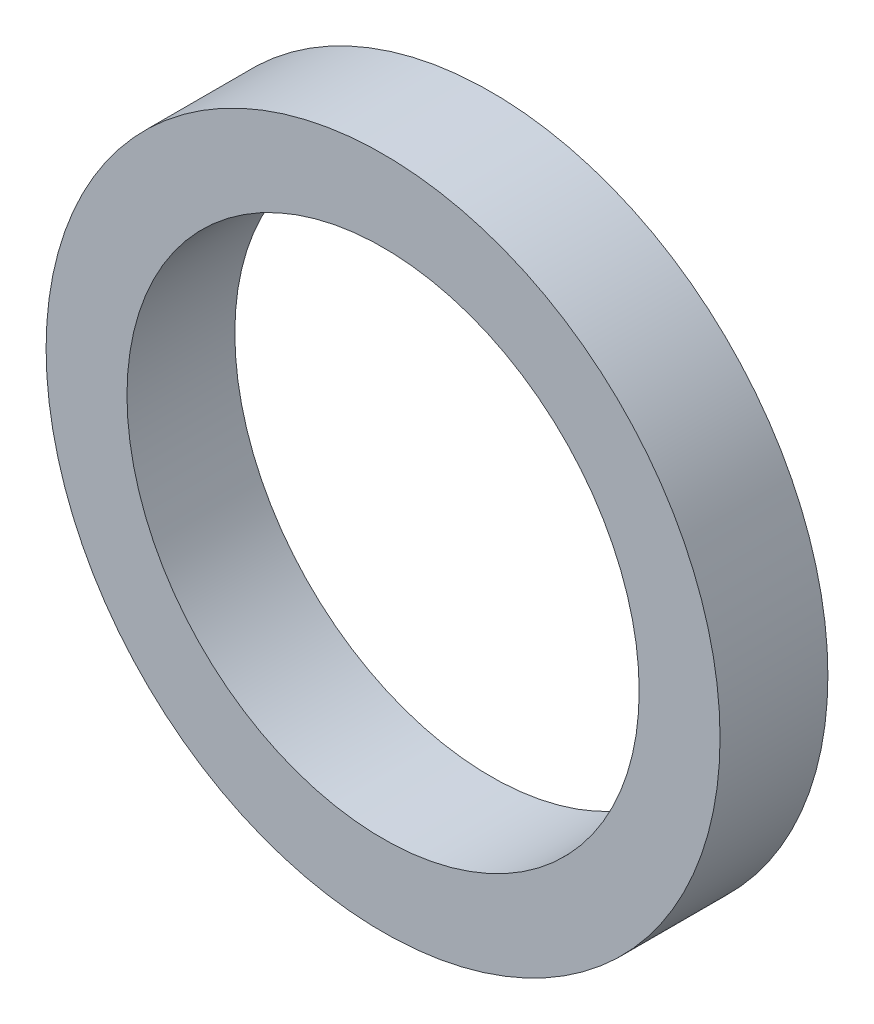
from build123d import *

# Parameters (mm, degrees)
SKETCH1_R           = 25
SKETCH1_R_2         = 19
BOSS_EXTRUDE1_DEPTH = 8


with BuildPart() as part:
    # Sketch1 → Boss-Extrude1 (new body)
    with BuildSketch(Plane.XY):
        Circle(SKETCH1_R)
        Circle(SKETCH1_R_2, mode=Mode.SUBTRACT)
    extrude(amount=BOSS_EXTRUDE1_DEPTH)


solid = part.part
